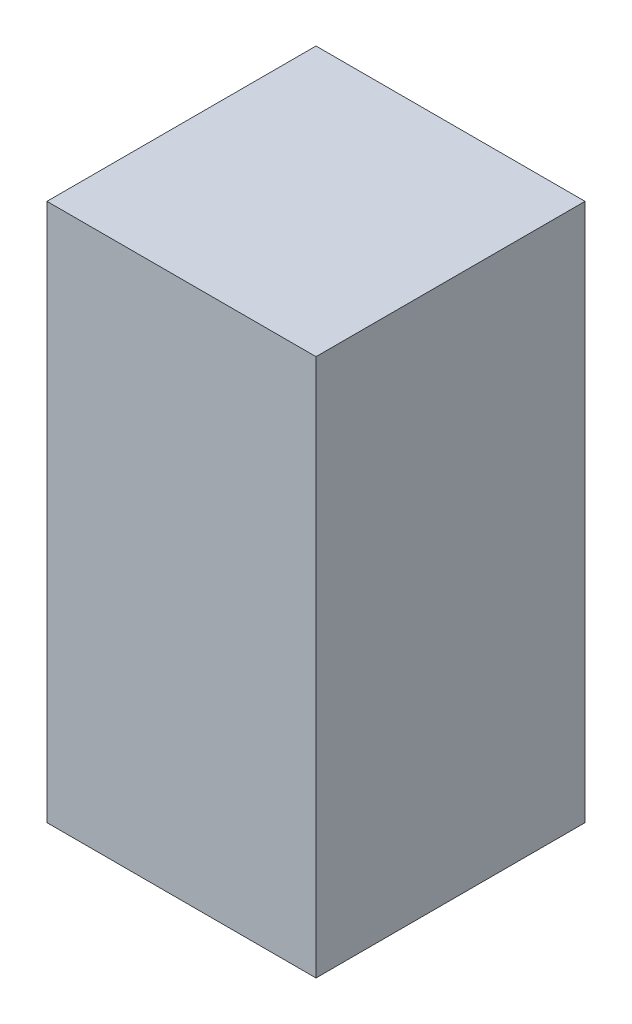
from build123d import *

# Parameters (mm, degrees)
SKETCH1_W           = 10
SKETCH1_H           = 10
BOSS_EXTRUDE1_DEPTH = 20


with BuildPart() as part:
    # Sketch1 → Boss-Extrude1 (new body)
    with BuildSketch(Plane(origin=(0, 0, 0), x_dir=(1, 0, 0), z_dir=(0, 1, 0))):
        with Locations((5, 5)):
            Rectangle(SKETCH1_W, SKETCH1_H)
    extrude(amount=BOSS_EXTRUDE1_DEPTH)


solid = part.part
